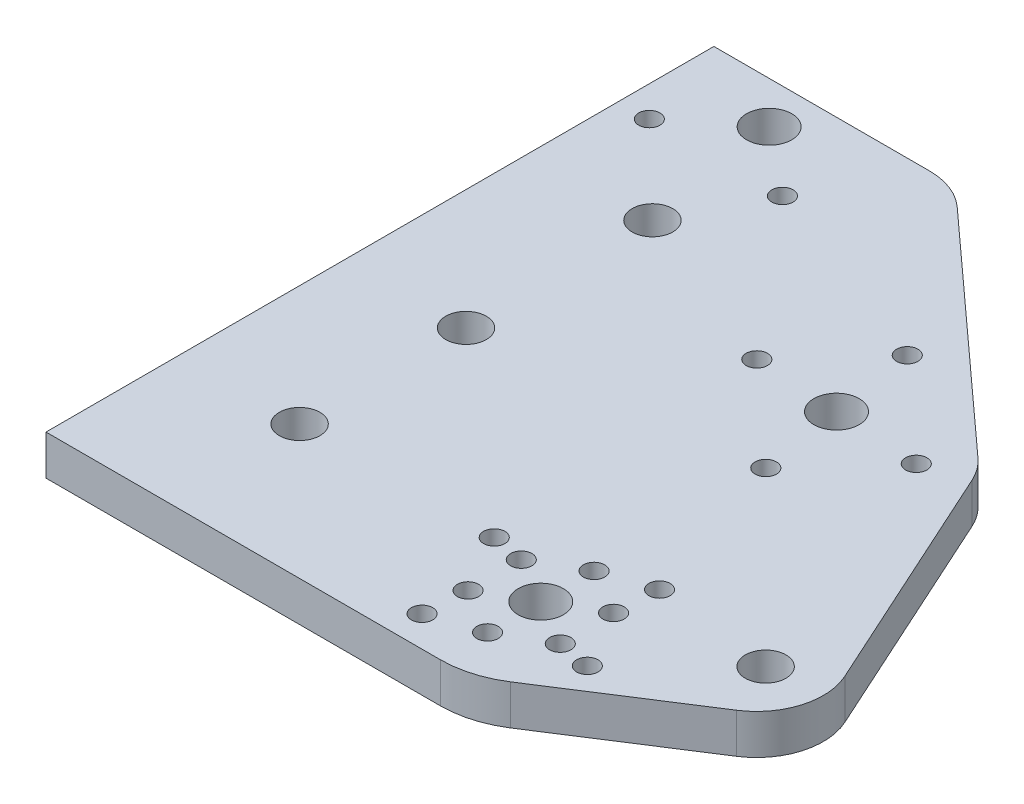
from build123d import *

# Parameters (mm, degrees)
ESBO_O1_R                = 3.4
ESBO_O1_R_2              = 1.6
ESBO_O1_R_3              = 3.05
RESSALTO_EXTRUS_O1_DEPTH = 6
ESBO_O2_R                = 3.05
CORTE_EXTRUS_O1_DEPTH    = 10


with BuildPart() as part:
    # Esboço1 → Ressalto-extrusão1 (new body)
    with BuildSketch(Plane.XZ.offset(6)):
        with BuildLine():
            ThreePointArc((148.858963728, -17.550205761), (150.213387743, -16.041631797), (151.235707119, -14.290882553))
            Line((151.235707119, -14.290882553), (167.194797105, 20.786465148))
            ThreePointArc((167.194797105, 20.786465148), (167.685761217, 27.75097204), (163.500492356, 33.339256802))
            Line((163.500492356, 33.339256802), (142.828800476, 46.629357452))
            ThreePointArc((142.828800476, 46.629357452), (138.919886426, 48.415130742), (134.666145804, 49.026919929))
            Line((134.666145804, 49.026919929), (75.43742995, 49.026919929))
            Line((75.43742995, 49.026919929), (75.43742995, -51.3))
            Line((75.43742995, -51.3), (107.856417314, -51.3))
            ThreePointArc((107.856417314, -51.3), (111.461591333, -50.627524875), (114.581887382, -48.700544058))
            Line((114.581887382, -48.700544058), (148.858963728, -17.550205761))
        make_face()
        with Locations(Location((90.03742995, -45, 0), (0, 0, 270))):
            Circle(ESBO_O1_R, mode=Mode.SUBTRACT)
        with Locations(Location((80.03742995, -37, 0), (0, 0, 270))):
            Circle(ESBO_O1_R_2, mode=Mode.SUBTRACT)
        with Locations(Location((100.03742995, -37, 0), (0, 0, 270))):
            Circle(ESBO_O1_R_2, mode=Mode.SUBTRACT)
        with Locations(Location((119.376459837, -13.805034822, 0), (0, 0, 270))):
            Circle(ESBO_O1_R_2, mode=Mode.SUBTRACT)
        with Locations(Location((130.137211947, -25.645905315, 0), (0, 0, 270))):
            Circle(ESBO_O1_R_2, mode=Mode.SUBTRACT)
        with Locations(Location((132.15737995, -13, 0), (0, 0, 270))):
            Circle(ESBO_O1_R, mode=Mode.SUBTRACT)
        with Locations(Location((144.938300063, -12.194965178, 0), (0, 0, 270))):
            Circle(ESBO_O1_R_2, mode=Mode.SUBTRACT)
        with Locations(Location((134.177547953, -0.354094685, 0), (0, 0, 270))):
            Circle(ESBO_O1_R_2, mode=Mode.SUBTRACT)
        with Locations(Location((122.816922322, 29.075437545, 0), (0, 0, 270))):
            Circle(ESBO_O1_R_2, mode=Mode.SUBTRACT)
        with Locations(Location((127.737942574, 29.932998956, 0), (0, 0, 270))):
            Circle(ESBO_O1_R_2, mode=Mode.SUBTRACT)
        with Locations(Location((134.666145804, 25.932998956, 0), (0, 0, 270))):
            Circle(ESBO_O1_R_2, mode=Mode.SUBTRACT)
        with Locations(Location((142.006279165, 23.439074893, 0), (0, 0, 270))):
            Circle(ESBO_O1_R_2, mode=Mode.SUBTRACT)
        with Locations(Location((134.666145804, 33.932998956, 0), (0, 0, 270))):
            Circle(ESBO_O1_R, mode=Mode.SUBTRACT)
        with Locations(Location((141.594349035, 29.932998956, 0), (0, 0, 270))):
            Circle(ESBO_O1_R_2, mode=Mode.SUBTRACT)
        with Locations(Location((127.737942574, 37.932998956, 0), (0, 0, 270))):
            Circle(ESBO_O1_R_2, mode=Mode.SUBTRACT)
        with Locations(Location((127.326012444, 44.426923019, 0), (0, 0, 270))):
            Circle(ESBO_O1_R_2, mode=Mode.SUBTRACT)
        with Locations(Location((134.666145804, 41.932998956, 0), (0, 0, 270))):
            Circle(ESBO_O1_R_2, mode=Mode.SUBTRACT)
        with Locations(Location((141.594349035, 37.932998956, 0), (0, 0, 270))):
            Circle(ESBO_O1_R_2, mode=Mode.SUBTRACT)
        with Locations(Location((159.995303964, 25.487660186, 0), (0, 0, 270))):
            Circle(ESBO_O1_R_3, mode=Mode.SUBTRACT)
        with Locations(Location((146.515369287, 38.790560368, 0), (0, 0, 270))):
            Circle(ESBO_O1_R_2, mode=Mode.SUBTRACT)
    extrude(amount=-RESSALTO_EXTRUS_O1_DEPTH)

    # Esboço2 → Corte-extrusão1 (cut)
    with BuildSketch(Plane.XZ.offset(6)):
        with Locations(Location((93.43742995, -24.067001044, 0), (0, 0, 270))):
            Circle(ESBO_O2_R)
        with Locations(Location((93.43742995, 3.932998956, 0), (0, 0, 270))):
            Circle(ESBO_O2_R)
        with Locations(Location((93.43742995, 28.932998956, 0), (0, 0, 270))):
            Circle(ESBO_O2_R)
    extrude(amount=-CORTE_EXTRUS_O1_DEPTH, mode=Mode.SUBTRACT)


solid = part.part
